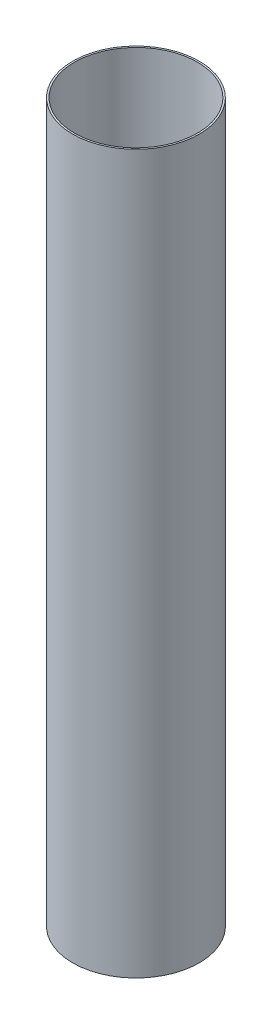
from build123d import *

# Parameters (mm, degrees)
SKETCH1_R           = 78.359
SKETCH1_R_2         = 76.2
BOSS_EXTRUDE1_DEPTH = 889


with BuildPart() as part:
    # Sketch1 → Boss-Extrude1 (new body)
    with BuildSketch(Plane(origin=(0, 0, 0), x_dir=(1, 0, 0), z_dir=(0, 1, 0))):
        with Locations(Location((0, 0, 0), (0, 0, 270))):
            Circle(SKETCH1_R)
        with Locations(Location((0, 0, 0), (0, 0, 270))):
            Circle(SKETCH1_R_2, mode=Mode.SUBTRACT)
    extrude(amount=BOSS_EXTRUDE1_DEPTH)


solid = part.part
